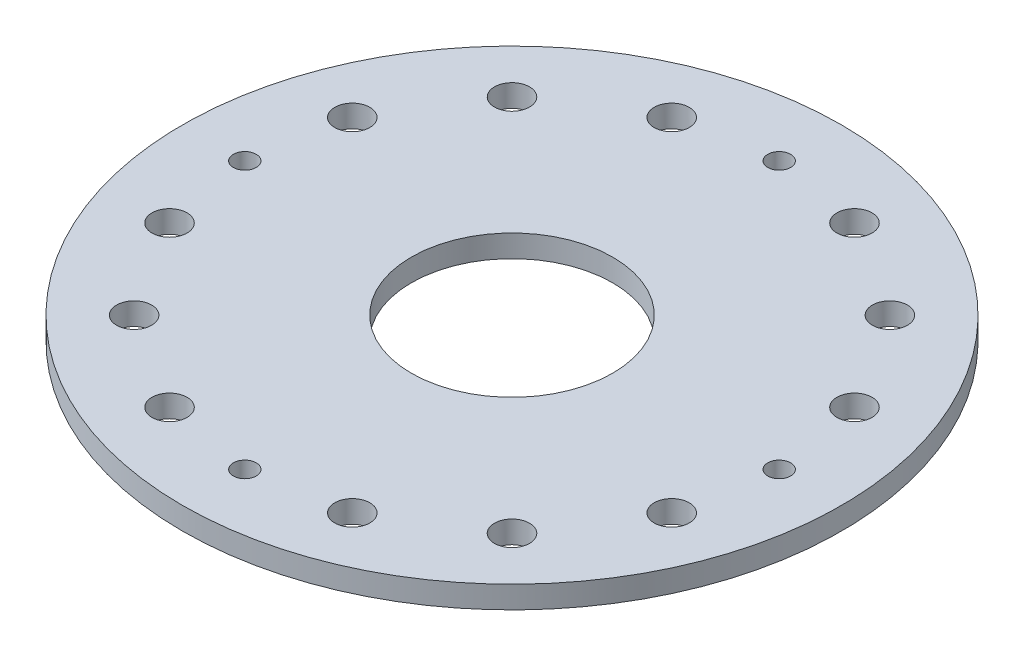
from build123d import *

# Parameters (mm, degrees)
SKETCH1_R                   = 46.99
BOSS_EXTRUDE1_DEPTH         = 3.175
SKETCH2_R                   = 14.351
CUT_EXTRUDE1_DEPTH          = 3.175
CIRPATTERN1_COUNT           = 4
SKETCH5_R                   = 2.5
CUT_EXTRUDE2_DEPTH          = 5.08
CIRPATTERN2_COUNT           = 4
CIRPATTERN3_COUNT           = 2
CIRPATTERN3_ANGLE           = 25
CIRPATTERN3_COPY_1_SKETCH_R = 2.5
CIRPATTERN3_COPY_1_DEPTH    = 5.08
CIRPATTERN3_COPY_2_SKETCH_R = 2.5
CIRPATTERN3_COPY_2_DEPTH    = 5.08
CIRPATTERN3_COPY_3_SKETCH_R = 2.5
CIRPATTERN3_COPY_3_DEPTH    = 5.08
CIRPATTERN4_COUNT           = 2
CIRPATTERN4_ANGLE           = 25
CIRPATTERN4_COPY_1_SKETCH_R = 2.5
CIRPATTERN4_COPY_1_DEPTH    = 5.08
CIRPATTERN4_COPY_2_SKETCH_R = 2.5
CIRPATTERN4_COPY_2_DEPTH    = 5.08
CIRPATTERN4_COPY_3_SKETCH_R = 2.5
CIRPATTERN4_COPY_3_DEPTH    = 5.08


with BuildPart() as part:
    # Sketch1 → Boss-Extrude1 (new body)
    with BuildSketch(Plane(origin=(0, 0, 0), x_dir=(1, 0, 0), z_dir=(0, 1, 0))):
        with Locations(Location((0, 0, 0), (0, 0, 270))):
            Circle(SKETCH1_R)
    extrude(amount=BOSS_EXTRUDE1_DEPTH)

    # Sketch2 → Cut-Extrude1 (cut)
    with BuildSketch(Plane(origin=(0, 3.175, 0), x_dir=(1, 0, 0), z_dir=(0, 1, 0))):
        with Locations(Location((0, 0, 0), (0, 0, 270))):
            Circle(SKETCH2_R)
    extrude(amount=-CUT_EXTRUDE1_DEPTH, mode=Mode.SUBTRACT)

    # Sketch3 → #4 Clearance Hole1 (revolve, cut)
    with BuildSketch(Plane(origin=(0, 3.175, -38.1), x_dir=(0, 0, 1), z_dir=(1, 0, 0))):
        Polygon((0, 0), (0, 11.140574487), (1.63195, 10.16), (1.63195, 0), align=None)
    f_4_clearance_hole1 = revolve(axis=Axis((0, 9.525, -38.1), (0, -1, 0)), mode=Mode.SUBTRACT)

    # CirPattern1: #4 Clearance Hole1 ×4 about axis
    cirpattern1_axis = Axis((0, 0, 0), (0, 1, 0))
    for i in range(1, CIRPATTERN1_COUNT):
        add(f_4_clearance_hole1.rotate(cirpattern1_axis, i * 360 / CIRPATTERN1_COUNT), mode=Mode.SUBTRACT)

    # Sketch5 → Cut-Extrude2 (cut)
    with BuildSketch(Plane(origin=(0, 3.175, 0), x_dir=(1, 0, 0), z_dir=(0, 1, 0))):
        with Locations(Location((-26.940768363, 26.940768363, 0), (0, 0, 270))):
            Circle(SKETCH5_R)
    cut_extrude2 = extrude(amount=-CUT_EXTRUDE2_DEPTH, mode=Mode.SUBTRACT)

    # CirPattern2: Cut-Extrude2 ×4 about axis
    cirpattern2_axis = Axis((0, 0, 0), (0, 1, 0))
    for i in range(1, CIRPATTERN2_COUNT):
        add(cut_extrude2.rotate(cirpattern2_axis, i * 360 / CIRPATTERN2_COUNT), mode=Mode.SUBTRACT)

    # CirPattern3: Cut-Extrude2 ×2 about axis
    cirpattern3_axis = Axis((0, 0, 0), (0, 1, 0))
    for i in range(1, CIRPATTERN3_COUNT):
        add(cut_extrude2.rotate(cirpattern3_axis, i * CIRPATTERN3_ANGLE / (CIRPATTERN3_COUNT - 1)), mode=Mode.SUBTRACT)

    # CirPattern3 copy 1 sketch → CirPattern3 copy 1 (cut)
    with BuildSketch(Plane(origin=(0, 3.175, 0), x_dir=(-0.4226182617407003, 0, -0.9063077870366495), z_dir=(0, 1, 0))):
        with Locations(Location((-26.940768363, 26.940768363, 0), (0, 0, 270))):
            Circle(CIRPATTERN3_COPY_1_SKETCH_R)
    extrude(amount=-CIRPATTERN3_COPY_1_DEPTH, mode=Mode.SUBTRACT)

    # CirPattern3 copy 2 sketch → CirPattern3 copy 2 (cut)
    with BuildSketch(Plane(origin=(0, 3.175, 0), x_dir=(-0.9063077870366495, 0, 0.4226182617407002), z_dir=(0, 1, 0))):
        with Locations(Location((-26.940768363, 26.940768363, 0), (0, 0, 270))):
            Circle(CIRPATTERN3_COPY_2_SKETCH_R)
    extrude(amount=-CIRPATTERN3_COPY_2_DEPTH, mode=Mode.SUBTRACT)

    # CirPattern3 copy 3 sketch → CirPattern3 copy 3 (cut)
    with BuildSketch(Plane(origin=(0, 3.175, 0), x_dir=(0.42261826174070016, 0, 0.9063077870366496), z_dir=(0, 1, 0))):
        with Locations(Location((-26.940768363, 26.940768363, 0), (0, 0, 270))):
            Circle(CIRPATTERN3_COPY_3_SKETCH_R)
    extrude(amount=-CIRPATTERN3_COPY_3_DEPTH, mode=Mode.SUBTRACT)

    # CirPattern4: Cut-Extrude2 ×2 about axis
    cirpattern4_axis = Axis((0, 0, 0), (0, -1, 0))
    for i in range(1, CIRPATTERN4_COUNT):
        add(cut_extrude2.rotate(cirpattern4_axis, i * CIRPATTERN4_ANGLE / (CIRPATTERN4_COUNT - 1)), mode=Mode.SUBTRACT)

    # CirPattern4 copy 1 sketch → CirPattern4 copy 1 (cut)
    with BuildSketch(Plane(origin=(0, 3.175, 0), x_dir=(0.4226182617407004, 0, -0.9063077870366495), z_dir=(0, 1, 0))):
        with Locations(Location((-26.940768363, 26.940768363, 0), (0, 0, 270))):
            Circle(CIRPATTERN4_COPY_1_SKETCH_R)
    extrude(amount=-CIRPATTERN4_COPY_1_DEPTH, mode=Mode.SUBTRACT)

    # CirPattern4 copy 2 sketch → CirPattern4 copy 2 (cut)
    with BuildSketch(Plane(origin=(0, 3.175, 0), x_dir=(-0.9063077870366495, 0, -0.42261826174070044), z_dir=(0, 1, 0))):
        with Locations(Location((-26.940768363, 26.940768363, 0), (0, 0, 270))):
            Circle(CIRPATTERN4_COPY_2_SKETCH_R)
    extrude(amount=-CIRPATTERN4_COPY_2_DEPTH, mode=Mode.SUBTRACT)

    # CirPattern4 copy 3 sketch → CirPattern4 copy 3 (cut)
    with BuildSketch(Plane(origin=(0, 3.175, 0), x_dir=(-0.4226182617407005, 0, 0.9063077870366494), z_dir=(0, 1, 0))):
        with Locations(Location((-26.940768363, 26.940768363, 0), (0, 0, 270))):
            Circle(CIRPATTERN4_COPY_3_SKETCH_R)
    extrude(amount=-CIRPATTERN4_COPY_3_DEPTH, mode=Mode.SUBTRACT)


solid = part.part
